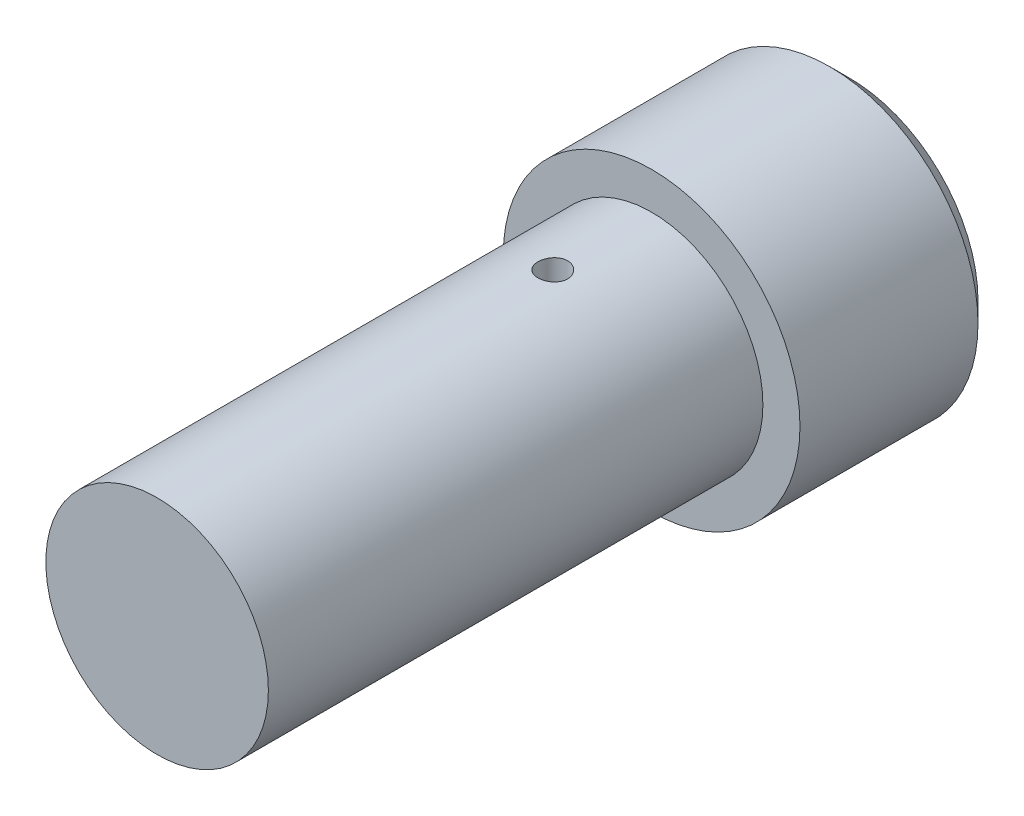
from build123d import *

# Parameters (mm, degrees)
ESQUISSE1_R             = 30
BASE_EXTRUSION_DEPTH    = 40
ESQUISSE2_R             = 22.5
BOSS_EXTRU_1_DEPTH      = 100
ESQUISSE3_R             = 3
ENL_V_MAT_EXTRU_1_DEPTH = 30
CHANFREIN1_SIZE         = 4


with BuildPart() as part:
    # Esquisse1 → Base-Extrusion (new body)
    with BuildSketch(Plane.XY):
        Circle(ESQUISSE1_R)
    extrude(amount=BASE_EXTRUSION_DEPTH)

    # Esquisse2 → Boss.-Extru.1 (add)
    with BuildSketch(Plane.XY.offset(40)):
        Circle(ESQUISSE2_R)
    extrude(amount=BOSS_EXTRU_1_DEPTH)

    # Esquisse3 → Enlèv. mat.-Extru.1 (cut)
    with BuildSketch(Plane(origin=(0, 30, 0), x_dir=(-1, 0, 0), z_dir=(0, 1, 0))):
        with Locations(Location((0, 60, 0), (0, 0, 90))):
            Circle(ESQUISSE3_R)
    extrude(amount=-ENL_V_MAT_EXTRU_1_DEPTH, mode=Mode.SUBTRACT)

    # Chanfrein1
    chanfrein1_edges = [part.edges().sort_by_distance(p)[0] for p in [
        (-30, 0, 0),
    ]]
    chamfer(chanfrein1_edges, length=CHANFREIN1_SIZE)


solid = part.part
